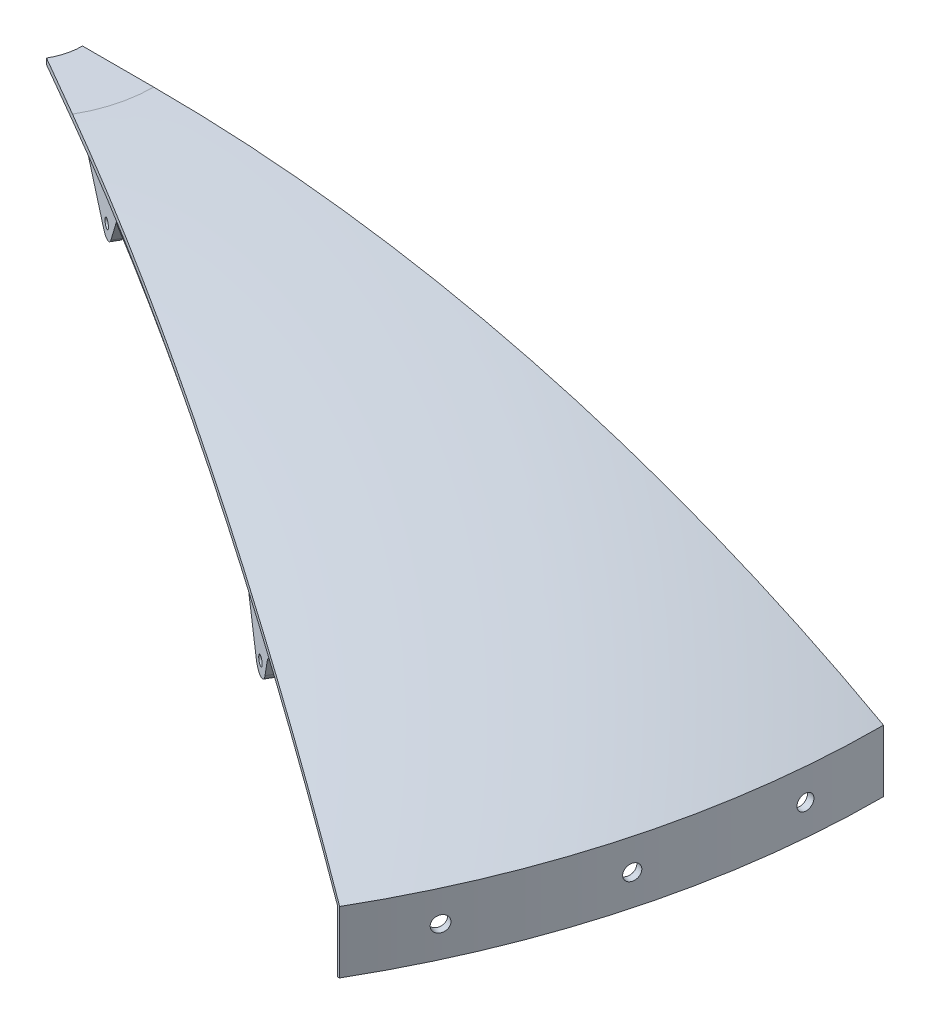
from build123d import *

# Parameters (mm, degrees)
REVOLVE1_ANGLE      = 30
SKETCH8_R           = 20
CUT_EXTRUDE1_DEPTH  = 10
SKETCH9_R           = 1.65
BOSS_EXTRUDE1_DEPTH = 3
BOSS_EXTRUDE2_DEPTH = 7.5
SKETCH10_R          = 2.75
CUT_EXTRUDE2_DEPTH  = 322.291633421
CIRPATTERN1_COUNT   = 3
CIRPATTERN1_ANGLE   = 20


with BuildPart() as part:
    # Sketch7 → Revolve1 (revolve)
    with BuildSketch(Plane.XY):
        with BuildLine():
            Line((45, 1.5), (0, 1.5))
            Line((0, 1.5), (0, -0.5))
            Line((0, -0.5), (0.5, -0.5))
            Line((0.5, -0.5), (45, -0.5))
            ThreePointArc((45, -0.5), (176.353256324, -17.04581533), (299.5, -65.649534053))
            Line((299.5, -65.649534053), (299.5, -85.057353814))
            Line((299.5, -85.057353814), (299.5, -87.3365737))
            ThreePointArc((299.5, -87.3365737), (300.500587667, -86.78965163), (301.5, -86.24058477))
            Line((301.5, -86.24058477), (301.5, -64.466303097))
            ThreePointArc((301.5, -64.466303097), (177.423377038, -15.255605667), (45, 1.5))
        make_face()
    revolve(axis=Axis((0, 0, 0), (0, -1, 0)), revolution_arc=REVOLVE1_ANGLE)

    # Sketch8 → Cut-Extrude1 (cut)
    with BuildSketch(Plane(origin=(0, 1.5, 0), x_dir=(1, 0, 0), z_dir=(0, 1, 0))):
        Circle(SKETCH8_R)
    extrude(amount=-CUT_EXTRUDE1_DEPTH, mode=Mode.SUBTRACT)

    # Sketch9 → Boss-Extrude1 (add)
    with BuildSketch(Plane(origin=(0, 0, 1.6), x_dir=(-1, 0, 0), z_dir=(0, 0, -1))):
        with BuildLine():
            ThreePointArc((-47.477373191, -0.005788221), (-173.847460419, -15.895397549), (-292.781250831, -61.465476862))
            Line((-292.781250831, -61.465476862), (-279.669089435, -61.465476862))
            ThreePointArc((-279.669089435, -61.465476862), (-255.073001384, -49.937778659), (-229.91274685, -39.699762977))
            ThreePointArc((-229.91274685, -39.699762977), (-227.597805944, -39.782747629), (-226.032061896, -41.489874873))
            Line((-226.032061896, -41.489874873), (-223.847573085, -47.552153691))
            ThreePointArc((-223.847573085, -47.552153691), (-220.219756041, -50.565420802), (-215.82374839, -48.857804945))
            Line((-215.82374839, -48.857804945), (-214.925668504, -46.947888182))
            Line((-214.925668504, -46.947888182), (-208.423927791, -33.120851453))
            ThreePointArc((-208.423927791, -33.120851453), (-207.69256892, -32.146690461), (-206.634183209, -31.543619054))
            ThreePointArc((-206.634183209, -31.543619054), (-144.562309401, -15.54254357), (-81.001445464, -7.237815383))
            Line((-81.001445464, -7.237815383), (-75.885042341, -16.035876247))
            ThreePointArc((-75.885042341, -16.035876247), (-72.834885241, -18.246061874), (-69.148521267, -17.472046696))
            Line((-69.148521267, -17.472046696), (-68.664438088, -17.071211426))
            Line((-68.664438088, -17.071211426), (-55.418958748, -6.103560573))
            Line((-55.418958748, -6.103560573), (-47.477373191, -0.005788221))
        make_face()
        with Locations((-219.472922513, -45.975786864)):
            Circle(SKETCH9_R, mode=Mode.SUBTRACT)
        with Locations((-71.865332392, -13.698263805)):
            Circle(SKETCH9_R, mode=Mode.SUBTRACT)
    boss_extrude1 = extrude(amount=-BOSS_EXTRUDE1_DEPTH)

    # Mirror1: Boss-Extrude1 across plane
    add(boss_extrude1.mirror(Plane(origin=(0, 0, 0), x_dir=(0.9659258262890681, 0, 0.2588190451025213), z_dir=(0.2588190451025213, 0, -0.9659258262890682))))

    # Sketch11 → Boss-Extrude2 (add, symmetric)
    with BuildSketch(Plane(origin=(0, -75.353443934, 0), x_dir=(1, 0, 0), z_dir=(0, 1, 0))):
        with BuildLine():
            Line((296.354521141, -43.29258365), (299.369908318, -8.826550513))
            ThreePointArc((299.369908318, -8.826550513), (298.360312078, -26.103144953), (296.354521141, -43.29258365))
        make_face()
    boss_extrude2 = extrude(amount=BOSS_EXTRUDE2_DEPTH, both=True)

    # Sketch10 → Cut-Extrude2 (cut, through all)
    with BuildSketch(Plane(origin=(300.352701475, 0, 26.277456438), x_dir=(0.08715574274765836, 0, -0.9961946980917455), z_dir=(0.9961946980917457, 0, 0.08715574274765837))):
        with Locations((0, -75.353443934)):
            Circle(SKETCH10_R)
    cut_extrude2 = extrude(amount=-CUT_EXTRUDE2_DEPTH, mode=Mode.SUBTRACT)

    # CirPattern1: Boss-Extrude2, Cut-Extrude2 ×3 about axis
    cirpattern1_axis = Axis((0, 0, 0), (0, -1, 0))
    add([boss_extrude2.rotate(cirpattern1_axis, i * CIRPATTERN1_ANGLE / (CIRPATTERN1_COUNT - 1)) for i in range(1, CIRPATTERN1_COUNT)])
    add([cut_extrude2.rotate(cirpattern1_axis, i * CIRPATTERN1_ANGLE / (CIRPATTERN1_COUNT - 1)) for i in range(1, CIRPATTERN1_COUNT)], mode=Mode.SUBTRACT)


solid = part.part
